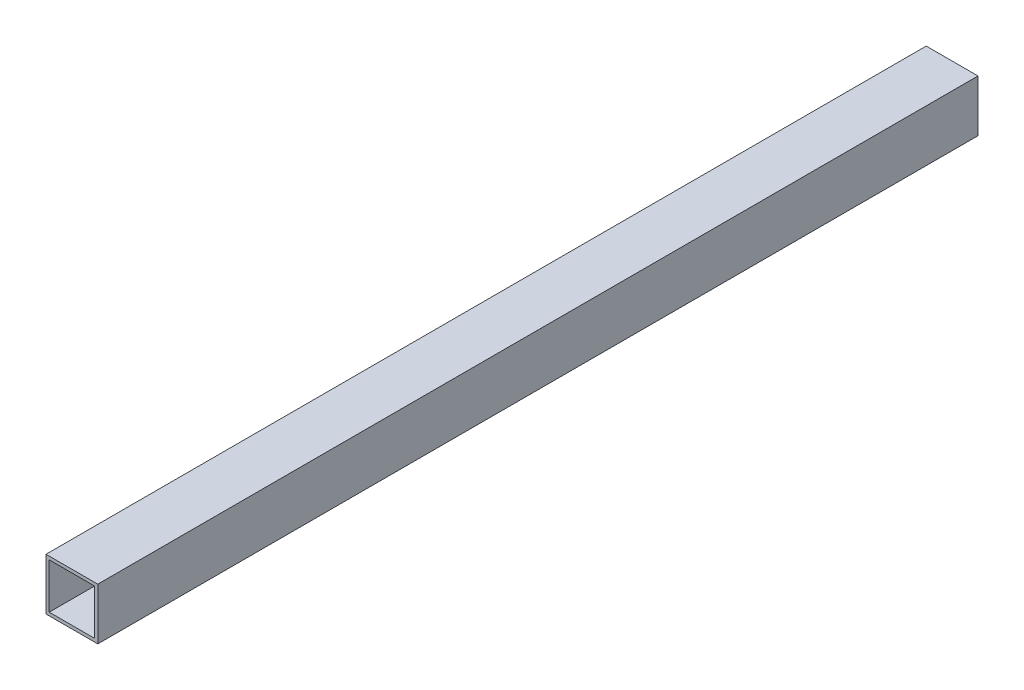
from build123d import *

# Parameters (mm, degrees)
SKETCH1_W           = 50.8
SKETCH1_H           = 50.8
BOSS_EXTRUDE1_DEPTH = 863.6
SHELL1_T            = -3.175


with BuildPart() as part:
    # Sketch1 → Boss-Extrude1 (new body)
    with BuildSketch(Plane.XY):
        Rectangle(SKETCH1_W, SKETCH1_H)
    extrude(amount=BOSS_EXTRUDE1_DEPTH)

    # Shell1
    shell1_openings = [part.faces().sort_by_distance(p)[0] for p in [
        (0, 0, 863.6),
        (0, 0, 0),
    ]]
    offset(amount=SHELL1_T, openings=shell1_openings, kind=Kind.INTERSECTION)


solid = part.part
